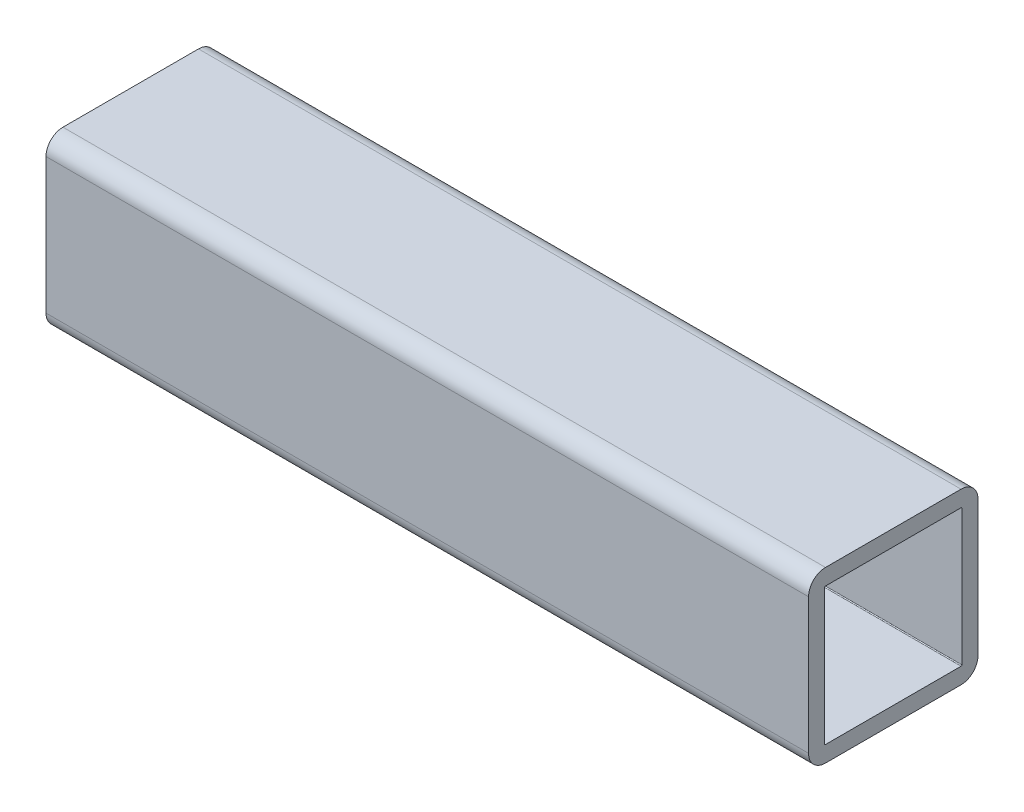
from build123d import *

# Parameters (mm, degrees)
SQUARE_TUBE_CONFIGURED_2_X_2_X_0_25_1_DEPTH = 114.3


with BuildPart() as part:
    # Sketch11 → Square tube - configured 2 X 2 X 0.25(1) (new body)
    with BuildSketch(Plane.YZ):
        with BuildLine():
            Line((-10.16, -12.7), (10.16, -12.7))
            ThreePointArc((10.16, -12.7), (11.956051224, -11.956051224), (12.7, -10.16))
            Line((12.7, -10.16), (12.7, 10.16))
            ThreePointArc((12.7, 10.16), (11.956051224, 11.956051224), (10.16, 12.7))
            Line((10.16, 12.7), (-10.16, 12.7))
            ThreePointArc((-10.16, 12.7), (-11.956051224, 11.956051224), (-12.7, 10.16))
            Line((-12.7, 10.16), (-12.7, -10.16))
            ThreePointArc((-12.7, -10.16), (-11.956051224, -11.956051224), (-10.16, -12.7))
        make_face()
        with BuildLine():
            Line((-10.16, -10.287), (10.16, -10.287))
            ThreePointArc((10.16, -10.287), (10.249802561, -10.249802561), (10.287, -10.16))
            Line((10.287, -10.16), (10.287, 10.16))
            ThreePointArc((10.287, 10.16), (10.249802561, 10.249802561), (10.16, 10.287))
            Line((10.16, 10.287), (-10.16, 10.287))
            ThreePointArc((-10.16, 10.287), (-10.249802561, 10.249802561), (-10.287, 10.16))
            Line((-10.287, 10.16), (-10.287, -10.16))
            ThreePointArc((-10.287, -10.16), (-10.249802561, -10.249802561), (-10.16, -10.287))
        make_face(mode=Mode.SUBTRACT)
    extrude(amount=SQUARE_TUBE_CONFIGURED_2_X_2_X_0_25_1_DEPTH)


solid = part.part
